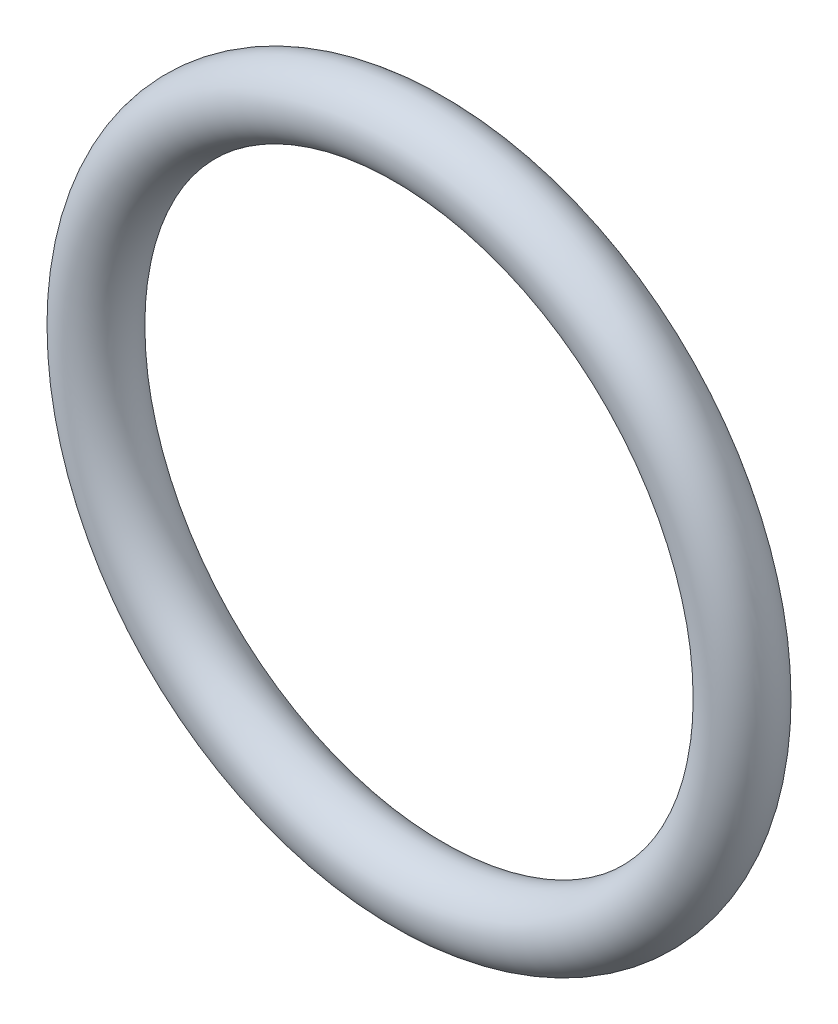
from build123d import *

# Parameters (mm, degrees)
SKETCH1_R = 1.5


with BuildPart() as part:
    # Sketch1 → Revolve1 (revolve)
    with BuildSketch(Plane(origin=(0, 0, 0), x_dir=(0, -1, 0), z_dir=(1, 0, 0)), mode=Mode.PRIVATE) as revolve1_sk:
        with Locations((14, 0)):
            Circle(SKETCH1_R)
    revolve(revolve1_sk.sketch.rotate(Axis((0, 0, 1.5), (0, 0, -1)), 270), axis=Axis((0, 0, 1.5), (0, 0, -1)))


solid = part.part
